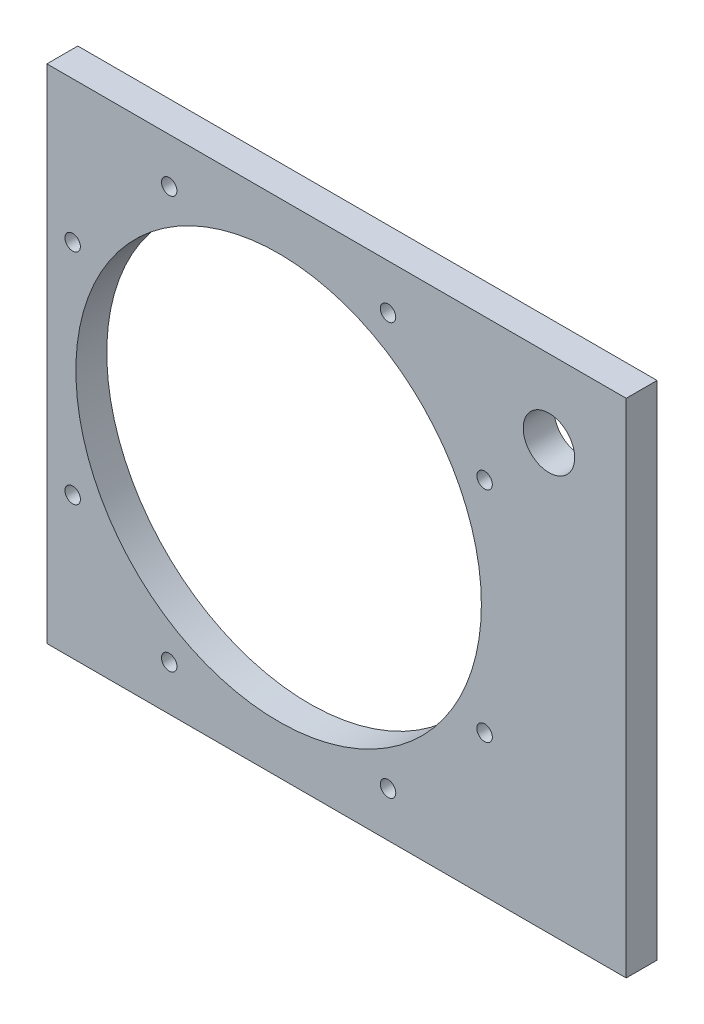
from build123d import *

# Parameters (mm, degrees)
SKETCH_1_W      = 450
SKETCH_1_H      = 390
SKETCH_1_R      = 157.5
SKETCH_1_R_2    = 6
SKETCH_1_R_3    = 20
EXTRUDE_1_DEPTH = 24


with BuildPart() as part:
    # 草图1 → 凸台-拉伸1 (new body)
    with BuildSketch(Plane.XY):
        Rectangle(SKETCH_1_W, SKETCH_1_H)
        with Locations((-45, 0)):
            Circle(SKETCH_1_R, mode=Mode.SUBTRACT)
        with Locations((-205, 85)):
            Circle(SKETCH_1_R_2, mode=Mode.SUBTRACT)
        with Locations(Location((-205, -85, 0), (0, 0, 180))):
            Circle(SKETCH_1_R_2, mode=Mode.SUBTRACT)
        with Locations((40, 160)):
            Circle(SKETCH_1_R_2, mode=Mode.SUBTRACT)
        with Locations(Location((-130, 160, 0), (0, 0, 180))):
            Circle(SKETCH_1_R_2, mode=Mode.SUBTRACT)
        with Locations((115, -85)):
            Circle(SKETCH_1_R_2, mode=Mode.SUBTRACT)
        with Locations(Location((115, 85, 0), (0, 0, 180))):
            Circle(SKETCH_1_R_2, mode=Mode.SUBTRACT)
        with Locations((-130, -160)):
            Circle(SKETCH_1_R_2, mode=Mode.SUBTRACT)
        with Locations(Location((40, -160, 0), (0, 0, 180))):
            Circle(SKETCH_1_R_2, mode=Mode.SUBTRACT)
        with Locations((165, 135)):
            Circle(SKETCH_1_R_3, mode=Mode.SUBTRACT)
    extrude(amount=EXTRUDE_1_DEPTH)


solid = part.part
